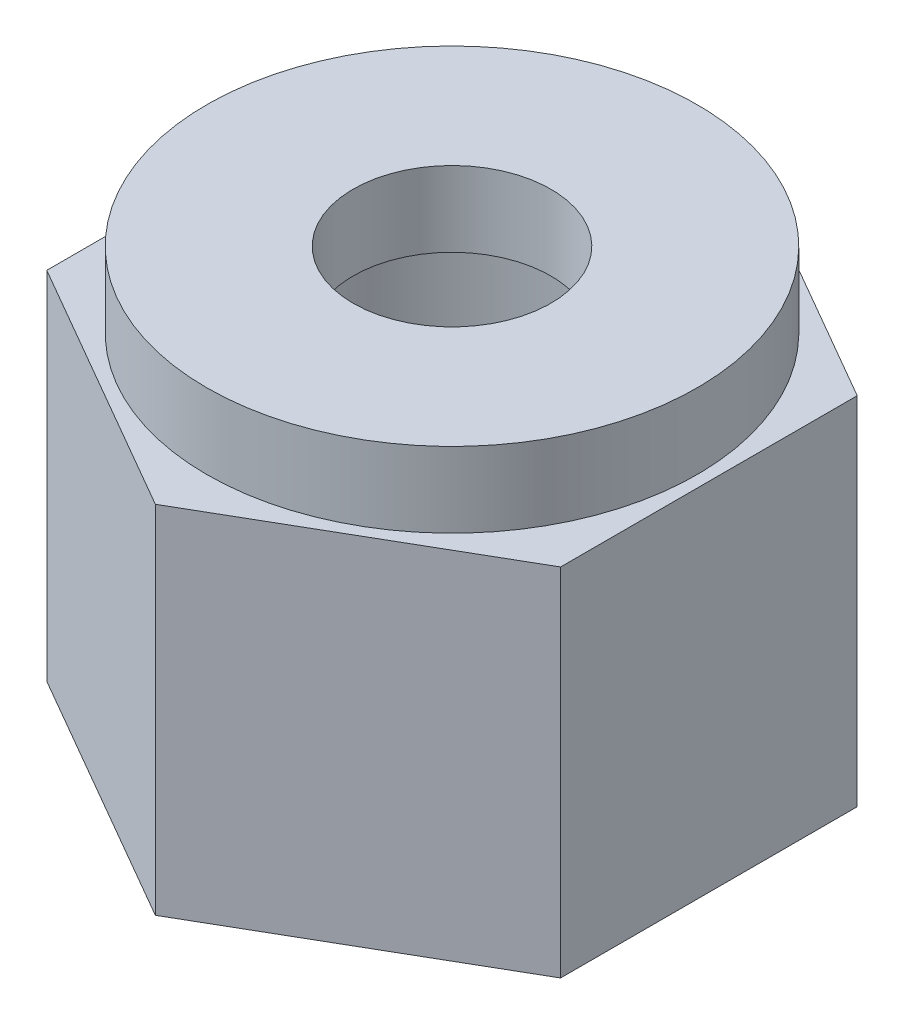
from build123d import *

# Parameters (mm, degrees)
SKETCH_3_R          = 10.188
CUT_EXTRUDE_1_DEPTH = 27.790856821
SKETCH_5_R          = 12.4
SKETCH_4_R          = 12.4
SKETCH_6_R          = 5
CUT_EXTRUDE_2_DEPTH = 30.478636501


with BuildPart() as part:
    # Эскиз2 → По сечениям1 section 0
    with BuildSketch(Plane(origin=(0, -18, 0), x_dir=(1, 0, 0), z_dir=(0, 1, 0))):
        with BuildLine():
            Line((-12.990381057, -7.5), (0, -15))
            Line((0, -15), (12.990381057, -7.5))
            Line((12.990381057, -7.5), (12.990381057, 7.5))
            Line((12.990381057, 7.5), (0, 15))
            Line((0, 15), (-12.990381057, 7.5))
            Line((-12.990381057, 7.5), (-12.990381057, -7.5))
        make_face()
    # Эскиз1 → По сечениям1 section 1
    with BuildSketch(Plane(origin=(0, 0, 0), x_dir=(1, 0, 0), z_dir=(0, 1, 0))):
        with BuildLine():
            Line((0, 15), (-12.990381057, 7.5))
            Line((-12.990381057, 7.5), (-12.990381057, -7.5))
            Line((-12.990381057, -7.5), (0, -15))
            Line((0, -15), (12.990381057, -7.5))
            Line((12.990381057, -7.5), (12.990381057, 7.5))
            Line((12.990381057, 7.5), (0, 15))
        make_face()
    loft()

    # Эскиз3 → Вырез-Вытянуть1 (cut, through all)
    with BuildSketch(Plane.XZ.offset(18)):
        with Locations(Location((0, 0, 0), (0, 0, 270))):
            Circle(SKETCH_3_R)
    extrude(amount=-CUT_EXTRUDE_1_DEPTH, mode=Mode.SUBTRACT)

    # Эскиз5 → По сечениям2 section 0
    with BuildSketch(Plane(origin=(0, 3.8, 0), x_dir=(1, 0, 0), z_dir=(0, 1, 0))):
        Circle(SKETCH_5_R)
    # Эскиз4 → По сечениям2 section 1
    with BuildSketch(Plane(origin=(0, 0, 0), x_dir=(1, 0, 0), z_dir=(0, 1, 0))):
        Circle(SKETCH_4_R)
    loft()

    # Эскиз6 → Вырез-Вытянуть2 (cut, through all)
    with BuildSketch(Plane(origin=(0, 3.8, 0), x_dir=(1, 0, 0), z_dir=(0, 1, 0))):
        with Locations(Location((0, 0, 0), (0, 0, 270))):
            Circle(SKETCH_6_R)
    extrude(amount=-CUT_EXTRUDE_2_DEPTH, mode=Mode.SUBTRACT)


solid = part.part
